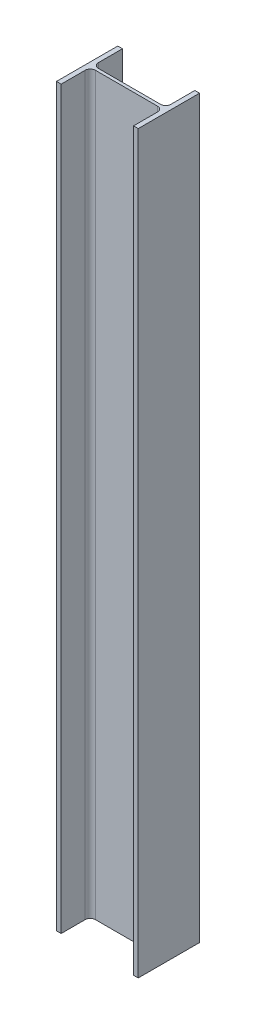
from build123d import *

# Parameters (mm, degrees)
AL_I_BEAM_AL_I_BEAM_4X2_31_1_DEPTH = 914.4


with BuildPart() as part:
    # Sketch11 → Al i beam AL I BEAM 4X2.31(1) (new body)
    with BuildSketch(Plane(origin=(53.975, -457.2, -38.1), x_dir=(0, 0, -1), z_dir=(0, 1, 0))):
        with BuildLine():
            Line((-38.1, -50.8), (-38.1, -44.958))
            Line((-38.1, -44.958), (-8.255, -44.958))
            ThreePointArc((-8.255, -44.958), (-3.764871939, -43.098128061), (-1.905, -38.608))
            Line((-1.905, -38.608), (-1.905, 38.608))
            ThreePointArc((-1.905, 38.608), (-3.764871939, 43.098128061), (-8.255, 44.958))
            Line((-8.255, 44.958), (-38.1, 44.958))
            Line((-38.1, 44.958), (-38.1, 50.8))
            Line((-38.1, 50.8), (38.1, 50.8))
            Line((38.1, 50.8), (38.1, 44.958))
            Line((38.1, 44.958), (8.255, 44.958))
            ThreePointArc((8.255, 44.958), (3.764871939, 43.098128061), (1.905, 38.608))
            Line((1.905, 38.608), (1.905, -38.608))
            ThreePointArc((1.905, -38.608), (3.764871939, -43.098128061), (8.255, -44.958))
            Line((8.255, -44.958), (38.1, -44.958))
            Line((38.1, -44.958), (38.1, -50.8))
            Line((38.1, -50.8), (-38.1, -50.8))
        make_face()
    extrude(amount=AL_I_BEAM_AL_I_BEAM_4X2_31_1_DEPTH)


solid = part.part
